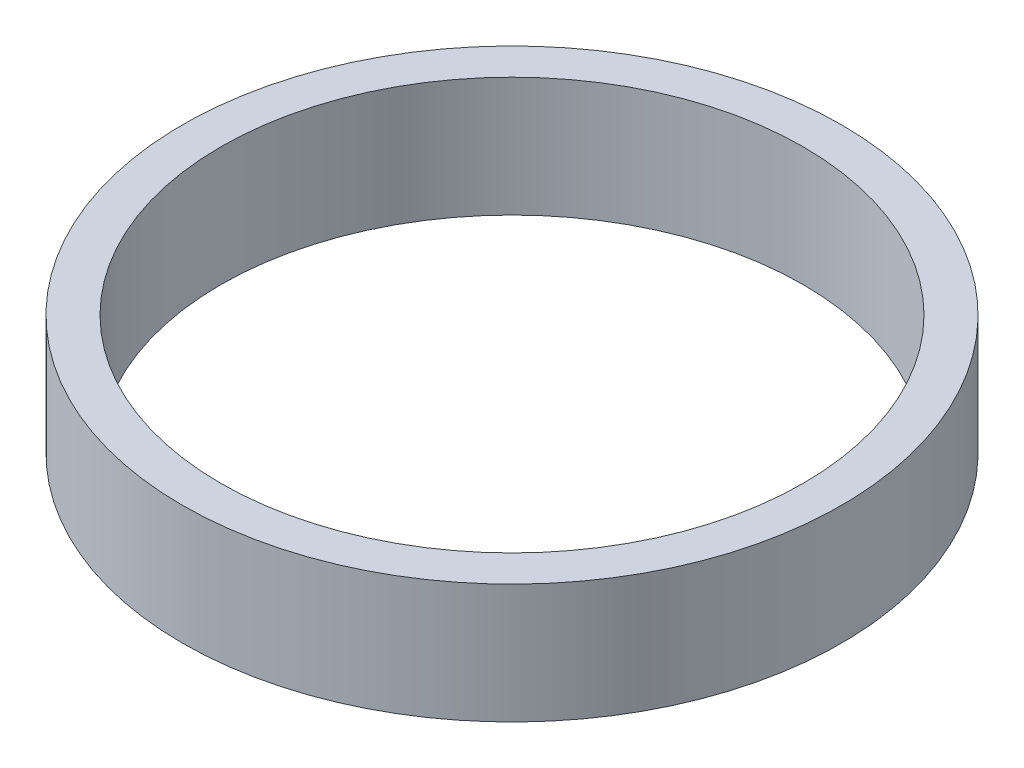
from build123d import *

# Parameters (mm, degrees)
SKETCH1_R           = 34.5
SKETCH1_R_2         = 30.5
BOSS_EXTRUDE1_DEPTH = 12.5


with BuildPart() as part:
    # Sketch1 → Boss-Extrude1 (new body)
    with BuildSketch(Plane(origin=(0, 0, 0), x_dir=(1, 0, 0), z_dir=(0, 1, 0))):
        with Locations(Location((0, 0, 0), (0, 0, 270))):
            Circle(SKETCH1_R)
        with Locations(Location((0, 0, 0), (0, 0, 270))):
            Circle(SKETCH1_R_2, mode=Mode.SUBTRACT)
    extrude(amount=BOSS_EXTRUDE1_DEPTH)


solid = part.part
